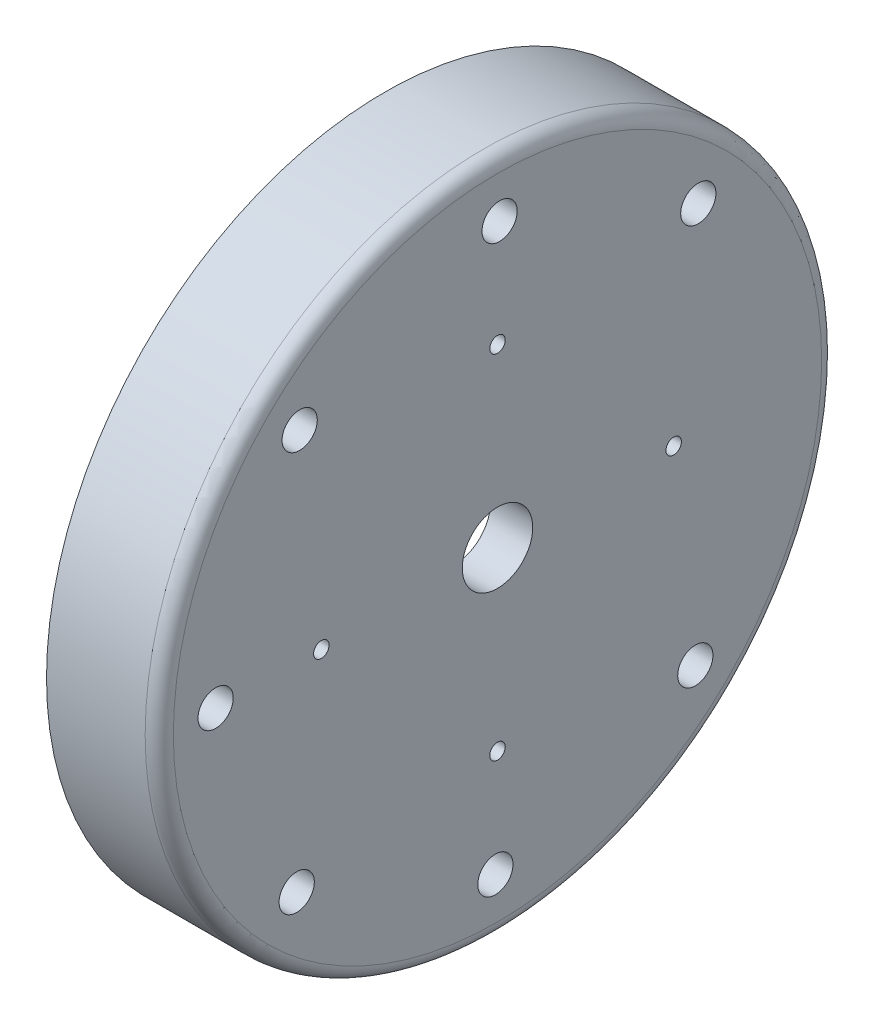
from build123d import *

# Parameters (mm, degrees)
SKETCH1_R           = 60.96
BOSS_EXTRUDE1_DEPTH = 20.32
FILLET1_R           = 2.54
SKETCH2_R           = 4.508
CUT_EXTRUDE1_DEPTH  = 6.35
SKETCH4_R           = 6.35
CUT_EXTRUDE3_DEPTH  = 89.572826533
SKETCH5_R           = 3.175
CUT_EXTRUDE4_DEPTH  = 89.572826533
CIRPATTERN2_COUNT   = 8
SKETCH6_R           = 34.925
CUT_EXTRUDE5_DEPTH  = 12.7
SKETCH7_R           = 1.397
CUT_EXTRUDE6_DEPTH  = 7.62


with BuildPart() as part:
    # Sketch1 → Boss-Extrude1 (new body)
    with BuildSketch(Plane(origin=(0, 0, 0), x_dir=(0, 0, -1), z_dir=(1, 0, 0))):
        Circle(SKETCH1_R)
    extrude(amount=BOSS_EXTRUDE1_DEPTH)

    # Fillet1
    fillet1_edges = [part.edges().sort_by_distance(p)[0] for p in [
        (20.32, 0, 60.96),
    ]]
    fillet(fillet1_edges, radius=FILLET1_R)

    # Sketch2 → Cut-Extrude1 (cut)
    with BuildSketch(Plane(origin=(20.32, 0, 0), x_dir=(0, 0, -1), z_dir=(1, 0, 0))):
        Circle(SKETCH2_R)
    extrude(amount=-CUT_EXTRUDE1_DEPTH, mode=Mode.SUBTRACT)

    # Sketch4 → Cut-Extrude3 (cut, through all)
    with BuildSketch(Plane(origin=(20.32, 0, 0), x_dir=(0, 0, -1), z_dir=(1, 0, 0))):
        Circle(SKETCH4_R)
    extrude(amount=-CUT_EXTRUDE3_DEPTH, mode=Mode.SUBTRACT)

    # Sketch5 → Cut-Extrude4 (cut, through all)
    with BuildSketch(Plane.ZY):
        with Locations((-36.188764222, 35.651274088)):
            Circle(SKETCH5_R)
    cut_extrude4 = extrude(amount=-CUT_EXTRUDE4_DEPTH, mode=Mode.SUBTRACT)

    # CirPattern2: Cut-Extrude4 ×8 about axis, 1 skipped
    cirpattern2_axis = Axis((0, 0, 0), (1, 0, 0))
    add([cut_extrude4.rotate(cirpattern2_axis, i * 360 / CIRPATTERN2_COUNT) for i in range(1, CIRPATTERN2_COUNT) if i not in (7,)], mode=Mode.SUBTRACT)

    # Sketch6 → Cut-Extrude5 (cut)
    with BuildSketch(Plane.ZY):
        Circle(SKETCH6_R)
    extrude(amount=-CUT_EXTRUDE5_DEPTH, mode=Mode.SUBTRACT)

    # Sketch7 → Cut-Extrude6 (cut)
    with BuildSketch(Plane.ZY.offset(-12.7)):
        with Locations((0, 31.75)):
            Circle(SKETCH7_R)
        with Locations((31.75, 0)):
            Circle(SKETCH7_R)
        with Locations((0, -31.75)):
            Circle(SKETCH7_R)
        with Locations((-31.75, 0)):
            Circle(SKETCH7_R)
    extrude(amount=-CUT_EXTRUDE6_DEPTH, mode=Mode.SUBTRACT)


solid = part.part
